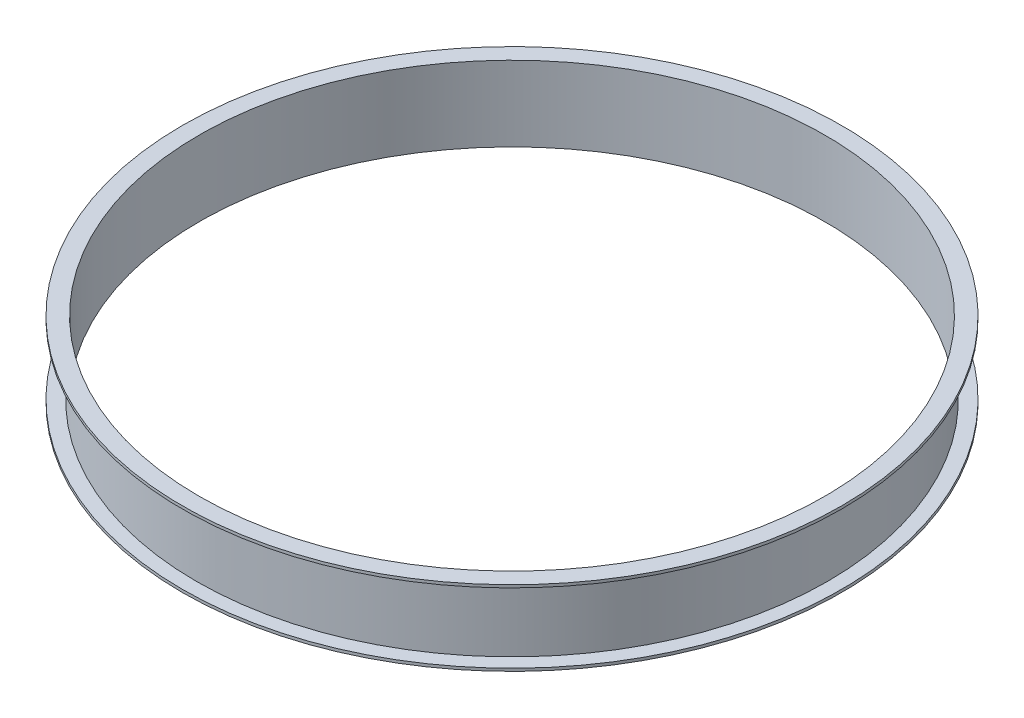
from build123d import *

# Parameters (mm, degrees)
SKETCH1_R           = 237
SKETCH1_R_2         = 225
BOSS_EXTRUDE1_DEPTH = 2
SKETCH2_R           = 227
SKETCH2_R_2         = 225
EXTRUDE_THIN1_DEPTH = 50
SKETCH3_R           = 237
SKETCH3_R_2         = 225
EXTRUDE_THIN2_DEPTH = 2


with BuildPart() as part:
    # Sketch1 → Boss-Extrude1 (new body)
    with BuildSketch(Plane(origin=(0, 0, 0), x_dir=(1, 0, 0), z_dir=(0, 1, 0))):
        with Locations(Location((0, 0, 0), (0, 0, 270))):
            Circle(SKETCH1_R)
        with Locations(Location((0, 0, 0), (0, 0, 270))):
            Circle(SKETCH1_R_2, mode=Mode.SUBTRACT)
    extrude(amount=BOSS_EXTRUDE1_DEPTH)

    # Sketch2 → Extrude-Thin1 (add)
    with BuildSketch(Plane(origin=(0, 2, 0), x_dir=(1, 0, 0), z_dir=(0, 1, 0))):
        Circle(SKETCH2_R)
        Circle(SKETCH2_R_2, mode=Mode.SUBTRACT)
    extrude(amount=EXTRUDE_THIN1_DEPTH)

    # Sketch3 → Extrude-Thin2 (add)
    with BuildSketch(Plane(origin=(0, 52, 0), x_dir=(1, 0, 0), z_dir=(0, 1, 0))):
        Circle(SKETCH3_R)
        Circle(SKETCH3_R_2, mode=Mode.SUBTRACT)
    extrude(amount=EXTRUDE_THIN2_DEPTH)


solid = part.part
